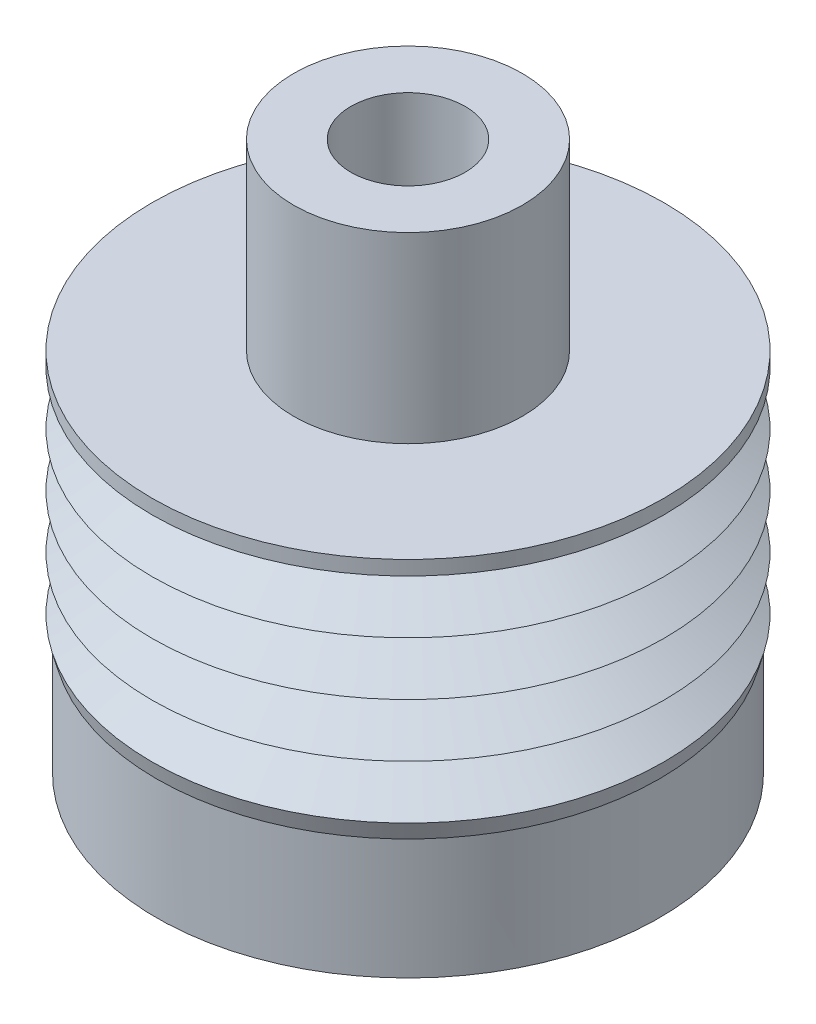
from build123d import *

# Parameters (mm, degrees)
CHANFRO1_SIZE            = 0.23
CHANFRO1_SIZE2           = 0.628371686
ESBO_O2_R                = 5
ESBO_O2_R_2              = 2.5
RESSALTO_EXTRUS_O1_DEPTH = 8


with BuildPart() as part:
    # Esboço1 → Revolução1 (revolve)
    with BuildSketch(Plane.XY, mode=Mode.PRIVATE) as revolu_o1_sk:
        Polygon((11, 0), (11, 5.894529946), (11.2, 6.01), (9.173500555, 7.18), (11.2, 8.35), (9.173500555, 9.52), (11.2, 10.69), (9.173500555, 11.86), (11.2, 13.03), (9.173500555, 14.2), (11.2, 15.37), (11.2, 16), (2.5, 16), (2.5, 0), align=None)
    revolve(revolu_o1_sk.sketch.rotate(Axis((0, 0, 0), (0, 1, 0)), 90), axis=Axis((0, 0, 0), (0, 1, 0)))

    # Chanfro1
    chanfro1_edges = [part.edges().sort_by_distance(p)[0] for p in [
        (0, 5.894529946, 11),
    ]]
    chanfro1_side = [part.faces().sort_by_distance(p)[0] for p in [
        (0, 5.952264973, 11.1),
    ]]
    chamfer(chanfro1_edges, length=CHANFRO1_SIZE, length2=CHANFRO1_SIZE2, reference=chanfro1_side[0])

    # Esboço2 → Ressalto-extrusão1 (add)
    with BuildSketch(Plane(origin=(0, 16, 0), x_dir=(1, 0, 0), z_dir=(0, 1, 0))):
        with Locations(Location((0, 0, 0), (0, 0, 270))):
            Circle(ESBO_O2_R)
        with Locations(Location((0, 0, 0), (0, 0, 90))):
            Circle(ESBO_O2_R_2, mode=Mode.SUBTRACT)
    extrude(amount=RESSALTO_EXTRUS_O1_DEPTH)


solid = part.part
